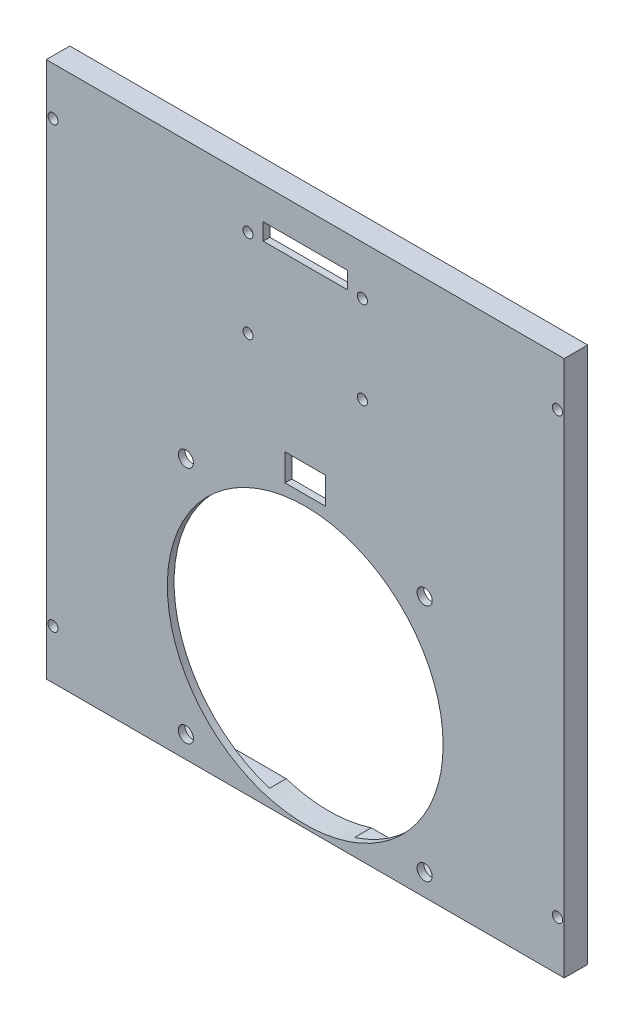
from build123d import *

# Parameters (mm, degrees)
SCHIZZO1_W                   = 154
SCHIZZO1_H                   = 160
SCHIZZO1_R                   = 1.5
ESTRUSIONE_ESTRUSIONE1_DEPTH = 7
SCHIZZO2_R                   = 41
SCHIZZO2_R_2                 = 2.25
SCHIZZO2_W                   = 12
SCHIZZO2_H                   = 8
TAGLIO_ESTRUSIONE1_DEPTH     = 10
SCHIZZO3_R                   = 1.5
SCHIZZO3_W                   = 25
SCHIZZO3_H                   = 5
TAGLIO_ESTRUSIONE2_DEPTH     = 10
SCHIZZO5_W                   = 140
SCHIZZO5_H                   = 154
TAGLIO_ESTRUSIONE3_DEPTH     = 5
SCHIZZO6_R                   = 3
SCHIZZO6_R_2                 = 1.5
ESTRUSIONE_ESTRUSIONE2_DEPTH = 3
RACCORDO1_R                  = 2
SCHIZZO8_W                   = 154
SCHIZZO8_H                   = 7
TAGLIO_ESTRUSIONE4_DEPTH     = 0.5


with BuildPart() as part:
    # Schizzo1 → Estrusione-Estrusione1 (new body)
    with BuildSketch(Plane.XY):
        Rectangle(SCHIZZO1_W, SCHIZZO1_H)
        with Locations((-75, 65.34394728)):
            Circle(SCHIZZO1_R, mode=Mode.SUBTRACT)
        with Locations(Location((75, 65.34394728, 0), (0, 0, 180))):
            Circle(SCHIZZO1_R, mode=Mode.SUBTRACT)
        with Locations((75, -65.34394728)):
            Circle(SCHIZZO1_R, mode=Mode.SUBTRACT)
        with Locations(Location((-75, -65.34394728, 0), (0, 0, 180))):
            Circle(SCHIZZO1_R, mode=Mode.SUBTRACT)
    extrude(amount=ESTRUSIONE_ESTRUSIONE1_DEPTH)

    # Schizzo2 → Taglio-Estrusione1 (cut)
    with BuildSketch(Plane(origin=(0, 0, 0), x_dir=(-1, 0, 0), z_dir=(0, 0, -1))):
        with Locations((0, -38)):
            Circle(SCHIZZO2_R)
        with Locations((35.499999997, -2.500000003)):
            Circle(SCHIZZO2_R_2)
        with Locations(Location((35.499999997, -73.499999997, 0), (0, 0, 180))):
            Circle(SCHIZZO2_R_2)
        with Locations(Location((-35.499999997, -2.500000003, 0), (0, 0, 180))):
            Circle(SCHIZZO2_R_2)
        with Locations((-35.499999997, -73.499999997)):
            Circle(SCHIZZO2_R_2)
        with Locations((0, 10)):
            Rectangle(SCHIZZO2_W, SCHIZZO2_H)
    extrude(amount=-TAGLIO_ESTRUSIONE1_DEPTH, mode=Mode.SUBTRACT)

    # Schizzo3 → Taglio-Estrusione2 (cut)
    with BuildSketch(Plane(origin=(0, 0, 0), x_dir=(-1, 0, 0), z_dir=(0, 0, -1))):
        with Locations((17, 65)):
            Circle(SCHIZZO3_R)
        with Locations((17, 39)):
            Circle(SCHIZZO3_R)
        with Locations(Location((-17, 39, 0), (0, 0, 180))):
            Circle(SCHIZZO3_R)
        with Locations(Location((-17, 65, 0), (0, 0, 180))):
            Circle(SCHIZZO3_R)
        with Locations((0, 67.5)):
            Rectangle(SCHIZZO3_W, SCHIZZO3_H)
    extrude(amount=-TAGLIO_ESTRUSIONE2_DEPTH, mode=Mode.SUBTRACT)

    # Schizzo5 → Taglio-Estrusione3 (cut)
    with BuildSketch(Plane(origin=(0, 0, 0), x_dir=(-1, 0, 0), z_dir=(0, 0, -1))):
        Rectangle(SCHIZZO5_W, SCHIZZO5_H)
    extrude(amount=-TAGLIO_ESTRUSIONE3_DEPTH, mode=Mode.SUBTRACT)

    # Schizzo6 → Estrusione-Estrusione2 (add)
    # profile 1 of 2: a face of its own
    with BuildSketch(Plane(origin=(0, 0, 5), x_dir=(-1, 0, 0), z_dir=(0, 0, -1))):
        with Locations(Location((8, 37, 0), (0, 0, 180))):
            Circle(SCHIZZO6_R)
        with Locations((8, 37)):
            Circle(SCHIZZO6_R_2, mode=Mode.SUBTRACT)
    # profile 2 of 2: a face of its own
    with BuildSketch(Plane(origin=(0, 0, 5), x_dir=(-1, 0, 0), z_dir=(0, 0, -1))):
        with Locations(Location((-8, 37, 0), (0, 0, 180))):
            Circle(SCHIZZO6_R)
        with Locations(Location((-8, 37, 0), (0, 0, 180))):
            Circle(SCHIZZO6_R_2, mode=Mode.SUBTRACT)
    extrude(amount=ESTRUSIONE_ESTRUSIONE2_DEPTH)

    # Raccordo1
    raccordo1_edges = [part.edges().sort_by_distance(p)[0] for p in [
        (-11, 37, 5),
        (5, 37, 5),
    ]]
    fillet(raccordo1_edges, radius=RACCORDO1_R)

    # Schizzo8 → Taglio-Estrusione4 (cut)
    with BuildSketch(Plane(origin=(0, 80, 0), x_dir=(1, 0, 0), z_dir=(0, 1, 0))):
        with Locations((0, -3.5)):
            Rectangle(SCHIZZO8_W, SCHIZZO8_H)
    extrude(amount=-TAGLIO_ESTRUSIONE4_DEPTH, mode=Mode.SUBTRACT)


solid = part.part
